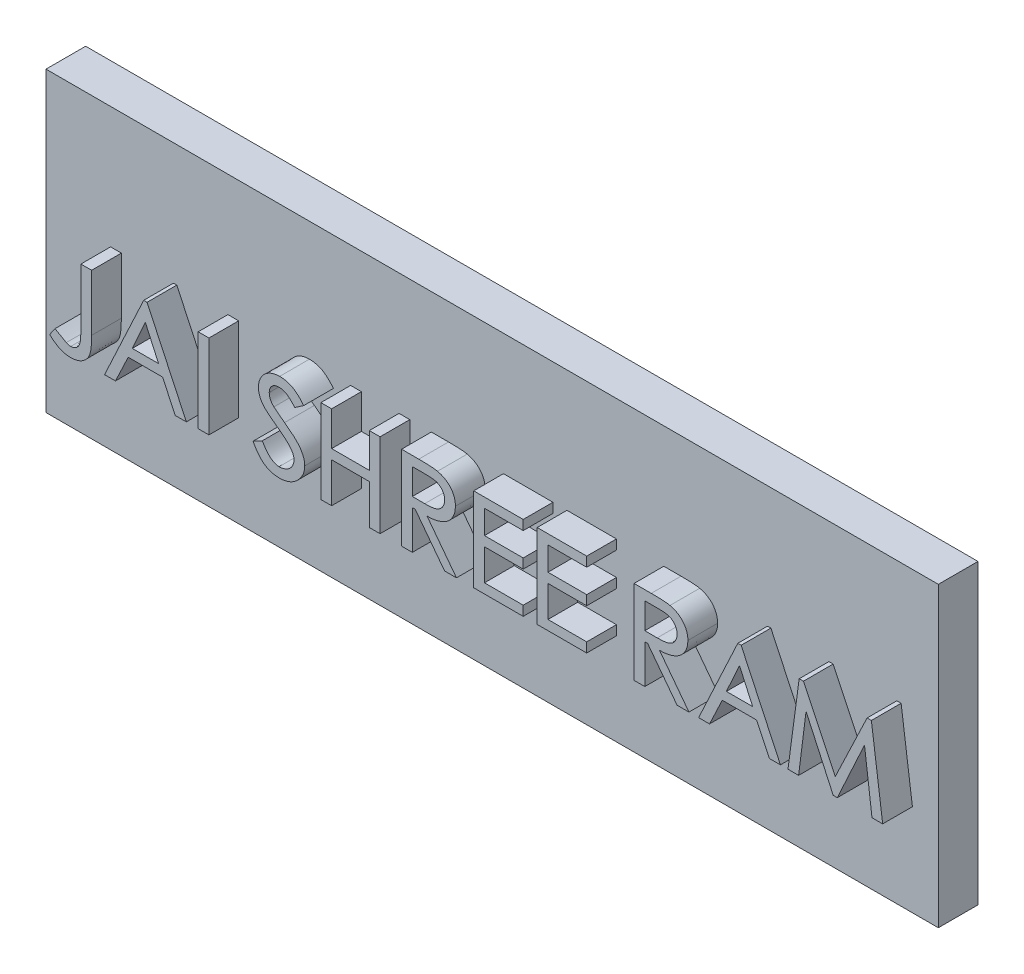
from build123d import *

# Parameters (mm, degrees)
SKETCH1_W           = 45
SKETCH1_H           = 15
BOSS_EXTRUDE1_DEPTH = 2
SKETCH2_W           = 0.542735043
SKETCH2_H           = 4.233333333
BOSS_EXTRUDE2_DEPTH = 1.5


with BuildPart() as part:
    # Sketch1 → Boss-Extrude1 (new body)
    with BuildSketch(Plane.XY):
        with Locations((22.5, 7.5)):
            Rectangle(SKETCH1_W, SKETCH1_H)
    extrude(amount=BOSS_EXTRUDE1_DEPTH)

    # Sketch2 → Boss-Extrude2 (add)
    # profile 1 of 11: a face of its own
    with BuildSketch(Plane.XY.offset(2)):
        with BuildLine():
            Line((3.258637598, 8.866404762), (3.801372641, 8.866404762))
            Line((3.801372641, 8.866404762), (3.801372641, 6.024677999))
            add(Edge.make_bspline(
                [(3.801372641, 6.024677999), (3.800962058, 5.973230325), (3.800172331, 5.874274331), (3.796559564, 5.73171127), (3.787848028, 5.601368951), (3.776693302, 5.482630425), (3.764224082, 5.375429481), (3.745925289, 5.280210179), (3.726352165, 5.196637917), (3.69467801, 5.101851328), (3.644727668, 4.995440013), (3.565170065, 4.880691951), (3.466364977, 4.778473084), (3.370394301, 4.703855635), (3.285042999, 4.652615476), (3.217213985, 4.617272433), (3.144983697, 4.58857176), (3.069009954, 4.566051015), (2.990099474, 4.547168402), (2.907397898, 4.533454315), (2.820915713, 4.525990227), (2.76199215, 4.525018687), (2.732015002, 4.52452442)],
                knots=[0, 0, 0, 0, 1.452672516, 2.794113746, 4.025812556, 5.140045592, 6.161674878, 7.071150553, 7.876425152, 8.583113845, 9.889795866, 11.180512384, 12.507055147, 13.889560834, 14.598589264, 15.316057477, 16.046722018, 16.789019803, 17.55176036, 18.336401437, 19.153650307, 20, 20, 20, 20], degree=3))
            add(Edge.make_bspline(
                [(2.732015002, 4.52452442), (2.689819523, 4.525556754), (2.605857441, 4.527610929), (2.480735627, 4.54764256), (2.357023073, 4.577611765), (2.232489143, 4.622001312), (2.104586679, 4.684264418), (1.97155606, 4.770277619), (1.828567192, 4.876253569), (1.734405544, 4.959088483), (1.684705974, 5.002809677)],
                knots=[0, 0, 0, 0, 0.856854487, 1.704999893, 2.568796624, 3.440919207, 4.38635173, 5.452546826, 6.655425746, 8, 8, 8, 8], degree=3))
            Line((1.684705974, 5.002809677), (1.953529425, 5.392900489))
            add(Edge.make_bspline(
                [(1.953529425, 5.392900489), (1.984850011, 5.373304051), (2.045309364, 5.335476279), (2.133431429, 5.282390459), (2.214490972, 5.233720651), (2.289600717, 5.191582408), (2.357198669, 5.153271336), (2.418001351, 5.119957091), (2.472812477, 5.092699933), (2.50726186, 5.076530709), (2.52340122, 5.06895551)],
                knots=[0, 0, 0, 0, 1.351848167, 2.609525467, 3.764319947, 4.811191365, 5.760578872, 6.607529217, 7.347634558, 8, 8, 8, 8], degree=3))
            add(Edge.make_bspline(
                [(2.52340122, 5.06895551), (2.543585872, 5.060279223), (2.582202316, 5.043680108), (2.640455887, 5.027349548), (2.694743921, 5.014901078), (2.73025582, 5.013606534), (2.747279425, 5.012985959)],
                knots=[0, 0, 0, 0, 1.133394633, 2.168363871, 3.121954873, 4, 4, 4, 4], degree=3))
            add(Edge.make_bspline(
                [(2.747279425, 5.012985959), (2.772542931, 5.014102581), (2.822583445, 5.016314322), (2.895480132, 5.034775878), (2.964401837, 5.065049073), (3.028889533, 5.106742081), (3.087157591, 5.158999479), (3.137007471, 5.221271073), (3.178102358, 5.291985958), (3.20326889, 5.35907051), (3.22055204, 5.420587542), (3.229523139, 5.478155039), (3.239289434, 5.545629846), (3.24680294, 5.62343926), (3.251226911, 5.711733179), (3.255795015, 5.810371945), (3.258167104, 5.91922899), (3.258476561, 5.995278999), (3.258637598, 6.034854281)],
                knots=[0, 0, 0, 0, 0.93789549, 1.85772999, 2.77510142, 3.725098534, 4.6996409, 5.670950193, 6.678238788, 7.725916441, 8.324833892, 9.050260382, 9.888218126, 10.859356959, 11.953767278, 13.173560852, 14.529163492, 16, 16, 16, 16], degree=3))
            Line((3.258637598, 6.034854281), (3.258637598, 8.866404762))
        make_face()
    # profile 2 of 11: a face of its own
    with BuildSketch(Plane.XY.offset(2)):
        Polygon((6.596458111, 8.866404762), (8.577441017, 4.633071429), (8.020289575, 4.633071429), (7.377487758, 5.989909036), (5.645823763, 5.989909036), (5.003021946, 4.633071429), (4.452654692, 4.633071429), (6.42685341, 8.866404762), align=None)
        Polygon((6.511655761, 7.941211119), (5.852741498, 6.478370574), (7.177354211, 6.478370574), align=None, mode=Mode.SUBTRACT)
    # profile 3 of 11: a face of its own
    with BuildSketch(Plane.XY.offset(2)):
        with Locations((9.445817085, 6.749738095)):
            Rectangle(SKETCH2_W, SKETCH2_H)
    # profile 4 of 11: a face of its own
    with BuildSketch(Plane.XY.offset(2)):
        with BuildLine():
            Line((11.942398282, 5.472614698), (12.403723068, 5.718541514))
            add(Edge.make_bspline(
                [(12.403723068, 5.718541514), (12.437342401, 5.662853683), (12.501598259, 5.55641881), (12.60710964, 5.413038399), (12.712016531, 5.290772592), (12.817354486, 5.189744837), (12.924586731, 5.111577941), (13.032618543, 5.055085092), (13.142126073, 5.019577458), (13.216167649, 5.015159503), (13.252594596, 5.012985959)],
                knots=[0, 0, 0, 0, 1.354943589, 2.589672558, 3.704607527, 4.708856974, 5.624398268, 6.459549776, 7.242129862, 8, 8, 8, 8], degree=3))
            add(Edge.make_bspline(
                [(13.252594596, 5.012985959), (13.286601112, 5.01407907), (13.353958236, 5.016244208), (13.452926401, 5.035021294), (13.54875379, 5.063630952), (13.639779891, 5.104370471), (13.723875504, 5.154281378), (13.798113444, 5.213648261), (13.861102267, 5.280860321), (13.91301966, 5.35500578), (13.95371561, 5.434170554), (13.983674075, 5.516108278), (14.001256705, 5.601055046), (14.003604608, 5.658252188), (14.004791444, 5.687164645)],
                knots=[0, 0, 0, 0, 1.0888553, 2.156709112, 3.216967111, 4.287545289, 5.343926646, 6.34269433, 7.323221176, 8.28571565, 9.233736345, 10.167849744, 11.073870434, 12, 12, 12, 12], degree=3))
            add(Edge.make_bspline(
                [(14.004791444, 5.687164645), (14.003128576, 5.720115719), (13.999768299, 5.786702303), (13.972797902, 5.88561747), (13.928966084, 5.983564798), (13.888420665, 6.044719495), (13.867411637, 6.076407433)],
                knots=[0, 0, 0, 0, 0.941861274, 1.903286225, 2.913566088, 4, 4, 4, 4], degree=3))
            add(Edge.make_bspline(
                [(13.867411637, 6.076407433), (13.84924505, 6.099473952), (13.811002842, 6.148030932), (13.74626963, 6.221134221), (13.670523277, 6.297391797), (13.583886654, 6.376459635), (13.487882573, 6.460109409), (13.380880247, 6.546179148), (13.263636107, 6.636123444), (13.181474668, 6.696465112), (13.138959446, 6.727689484)],
                knots=[0, 0, 0, 0, 0.718593868, 1.512701116, 2.388487339, 3.348232282, 4.383172848, 5.504845107, 6.708858268, 8, 8, 8, 8], degree=3))
            add(Edge.make_bspline(
                [(13.138959446, 6.727689484), (13.095605049, 6.75920673), (13.0124201, 6.819679498), (12.895219771, 6.908332857), (12.79013827, 6.990076166), (12.697981401, 7.064973316), (12.618738692, 7.133675281), (12.552577072, 7.195900145), (12.497504804, 7.249940294), (12.467910537, 7.286301043), (12.454604478, 7.30264942)],
                knots=[0, 0, 0, 0, 1.435833971, 2.754963323, 3.936484598, 5.002077172, 5.935979083, 6.744956812, 7.435712417, 8, 8, 8, 8], degree=3))
            add(Edge.make_bspline(
                [(12.454604478, 7.30264942), (12.435179432, 7.327748471), (12.397017365, 7.377057575), (12.348702868, 7.456152571), (12.307129325, 7.536282736), (12.272887348, 7.618190026), (12.246351878, 7.701612775), (12.228096729, 7.78684354), (12.215219864, 7.873543767), (12.214252236, 7.932118031), (12.213765803, 7.961563683)],
                knots=[0, 0, 0, 0, 1.064105702, 2.090521257, 3.104283852, 4.09061442, 5.065433238, 6.036507983, 7.012940167, 8, 8, 8, 8], degree=3))
            add(Edge.make_bspline(
                [(12.213765803, 7.961563683), (12.215297639, 8.007483687), (12.218330562, 8.098401934), (12.245433903, 8.231128955), (12.289355334, 8.357594102), (12.349307621, 8.477143748), (12.425865599, 8.587552585), (12.516928203, 8.686640166), (12.622988143, 8.77229215), (12.741215562, 8.844463012), (12.868650779, 8.902994061), (13.002869928, 8.944712312), (13.1422459, 8.970003394), (13.236942785, 8.973290089), (13.284819489, 8.974951771)],
                knots=[0, 0, 0, 0, 1.004530234, 1.988896367, 2.951881425, 3.928924249, 4.907494835, 5.884204368, 6.865296418, 7.88218147, 8.909671266, 9.927572845, 10.952225504, 12, 12, 12, 12], degree=3))
            add(Edge.make_bspline(
                [(13.284819489, 8.974951771), (13.339180754, 8.973005986), (13.446843503, 8.969152349), (13.605548515, 8.943036875), (13.757309498, 8.896017757), (13.879536221, 8.844117383), (13.974484027, 8.791053337), (14.046294995, 8.743127418), (14.119897533, 8.688888923), (14.192960432, 8.625634104), (14.268331285, 8.556423465), (14.342150501, 8.477494877), (14.419089705, 8.393371834), (14.468127939, 8.33270443), (14.493252983, 8.301621108)],
                knots=[0, 0, 0, 0, 1.360590218, 2.69465552, 4.010645498, 5.328858611, 6.009843139, 6.729980544, 7.488405022, 8.296451933, 9.147430815, 10.048128915, 10.999946711, 12, 12, 12, 12], degree=3))
            Line((14.493252983, 8.301621108), (14.050584714, 7.998028694))
            add(Edge.make_bspline(
                [(14.050584714, 7.998028694), (14.027483055, 8.022695012), (13.983064365, 8.070122152), (13.917725393, 8.137381083), (13.855905817, 8.197741167), (13.797418024, 8.250926275), (13.743572933, 8.297884897), (13.692857548, 8.337033577), (13.646857803, 8.370680089), (13.589354041, 8.404027496), (13.518858768, 8.43705427), (13.432095628, 8.466770792), (13.341084831, 8.482652446), (13.279503216, 8.485201094), (13.248354478, 8.486490232)],
                knots=[0, 0, 0, 0, 1.253377364, 2.409930098, 3.477532466, 4.457083962, 5.341772995, 6.126101147, 6.832963523, 7.453284126, 8.588253012, 9.715448048, 10.844445545, 12, 12, 12, 12], degree=3))
            add(Edge.make_bspline(
                [(13.248354478, 8.486490232), (13.215106527, 8.484936486), (13.150469793, 8.481915877), (13.057622516, 8.456049441), (12.972273423, 8.415233088), (12.896971593, 8.357467019), (12.834383069, 8.285968092), (12.788481896, 8.202216156), (12.761619264, 8.106769692), (12.758255135, 8.039757611), (12.756500846, 8.004812882)],
                knots=[0, 0, 0, 0, 1.033513523, 2.009234674, 2.977584268, 3.963375862, 4.942860848, 5.915719707, 6.913112236, 8, 8, 8, 8], degree=3))
            add(Edge.make_bspline(
                [(12.756500846, 8.004812882), (12.757184372, 7.982169823), (12.75854977, 7.936938472), (12.768579007, 7.869937982), (12.787118048, 7.805199614), (12.810610758, 7.741358838), (12.843492504, 7.678774361), (12.885369369, 7.617347358), (12.935081074, 7.555308121), (12.973232979, 7.516307267), (12.993099404, 7.495998779)],
                knots=[0, 0, 0, 0, 0.940834015, 1.879392378, 2.805520916, 3.734846727, 4.701501436, 5.734192883, 6.820151034, 8, 8, 8, 8], degree=3))
            add(Edge.make_bspline(
                [(12.993099404, 7.495998779), (13.003158621, 7.486535564), (13.026246632, 7.4648155), (13.068592526, 7.43155564), (13.120184396, 7.38985666), (13.181737491, 7.340399161), (13.255275813, 7.285868264), (13.338080393, 7.222620858), (13.432247848, 7.153504268), (13.49851375, 7.105048848), (13.533290376, 7.079619239)],
                knots=[0, 0, 0, 0, 0.485581606, 1.114511607, 1.892484918, 2.819534315, 3.891398566, 5.11240712, 6.484579029, 8, 8, 8, 8], degree=3))
            add(Edge.make_bspline(
                [(13.533290376, 7.079619239), (13.580669607, 7.045084629), (13.67232638, 6.978276223), (13.802527973, 6.877504535), (13.919951421, 6.778723494), (14.02756547, 6.68537934), (14.121730796, 6.59355647), (14.204211739, 6.505142872), (14.276044104, 6.42100153), (14.352761932, 6.313723672), (14.42946438, 6.181468505), (14.498052222, 6.021613285), (14.538980738, 5.860496996), (14.544702438, 5.752961238), (14.547526487, 5.699884997)],
                knots=[0, 0, 0, 0, 1.186540699, 2.295404303, 3.331123753, 4.291760032, 5.17774712, 5.991329992, 6.738459906, 7.414799035, 8.65800623, 9.82461674, 10.926299804, 12, 12, 12, 12], degree=3))
            add(Edge.make_bspline(
                [(14.547526487, 5.699884997), (14.546324864, 5.662228178), (14.543936547, 5.587382372), (14.52662059, 5.476718055), (14.497808359, 5.369156135), (14.456356746, 5.265150809), (14.404654383, 5.163725962), (14.340546911, 5.065768311), (14.264243286, 4.971655327), (14.178962634, 4.880818319), (14.084663763, 4.797335568), (13.98353893, 4.723859736), (13.875896877, 4.662478435), (13.762567082, 4.612678164), (13.64421451, 4.572097128), (13.519669566, 4.544302513), (13.389548233, 4.52825905), (13.300976339, 4.525782415), (13.25598669, 4.52452442)],
                knots=[0, 0, 0, 0, 0.932646097, 1.853705421, 2.767602683, 3.685675702, 4.622099834, 5.5835355, 6.579838097, 7.620108014, 8.666886363, 9.695041649, 10.711275682, 11.730160242, 12.757671447, 13.80585424, 14.885494678, 16, 16, 16, 16], degree=3))
            add(Edge.make_bspline(
                [(13.25598669, 4.52452442), (13.223179727, 4.525253105), (13.158563575, 4.526688312), (13.062635884, 4.535792087), (12.96928629, 4.553289452), (12.878002991, 4.575911783), (12.788729014, 4.604718266), (12.702614854, 4.64156704), (12.618226511, 4.683892949), (12.536048077, 4.733452204), (12.455974758, 4.791482189), (12.377551509, 4.858843588), (12.301233871, 4.936720531), (12.225713597, 5.024101233), (12.15198841, 5.121968545), (12.08023043, 5.22980785), (12.009523436, 5.347271397), (11.965214351, 5.430010082), (11.942398282, 5.472614698)],
                knots=[0, 0, 0, 0, 0.916943493, 1.805999526, 2.689245248, 3.568702553, 4.433092864, 5.307568578, 6.183755457, 7.069823058, 7.986358083, 8.944343836, 9.955449961, 11.030835633, 12.170024038, 13.377301724, 14.649494474, 16, 16, 16, 16], degree=3))
        make_face()
    # profile 5 of 11: a face of its own
    with BuildSketch(Plane.XY.offset(2)):
        Polygon((15.361629051, 8.866404762), (15.904364094, 8.866404762), (15.904364094, 7.129652625), (17.803936743, 7.129652625), (17.803936743, 8.866404762), (18.346671786, 8.866404762), (18.346671786, 4.633071429), (17.803936743, 4.633071429), (17.803936743, 6.641191087), (15.904364094, 6.641191087), (15.904364094, 4.633071429), (15.361629051, 4.633071429), align=None)
    # profile 6 of 11: a face of its own
    with BuildSketch(Plane.XY.offset(2)):
        with BuildLine():
            Line((19.432141872, 8.866404762), (20.298821893, 8.866404762))
            add(Edge.make_bspline(
                [(20.298821893, 8.866404762), (20.354510546, 8.866270112), (20.461088644, 8.866012415), (20.614019768, 8.863308237), (20.75287716, 8.859726793), (20.877765766, 8.852245675), (20.989020022, 8.845642202), (21.086158736, 8.834781339), (21.169639244, 8.825094625), (21.21983031, 8.814437294), (21.242672053, 8.809587187)],
                knots=[0, 0, 0, 0, 1.411347063, 2.701065231, 3.876524531, 4.931206492, 5.871916627, 6.700262025, 7.408494688, 8, 8, 8, 8], degree=3))
            add(Edge.make_bspline(
                [(21.242672053, 8.809587187), (21.276730833, 8.80102524), (21.343831818, 8.7841569), (21.440504111, 8.750946713), (21.531771409, 8.711794285), (21.617513421, 8.666914957), (21.697936305, 8.616083305), (21.771484147, 8.557765857), (21.841054293, 8.494941523), (21.903962387, 8.425639258), (21.961199239, 8.351944482), (22.010138246, 8.273870183), (22.052128345, 8.192464901), (22.08717381, 8.107849646), (22.113377882, 8.019080835), (22.131732317, 7.926811794), (22.144363997, 7.831316557), (22.145329636, 7.766276996), (22.145817085, 7.73344536)],
                knots=[0, 0, 0, 0, 1.103820101, 2.174693741, 3.209859002, 4.223626675, 5.214778413, 6.196198804, 7.171320727, 8.158999421, 9.134971582, 10.10159085, 11.051641808, 12.012235658, 12.97676874, 13.956376421, 14.968389326, 16, 16, 16, 16], degree=3))
            add(Edge.make_bspline(
                [(22.145817085, 7.73344536), (22.14400249, 7.679298674), (22.140436198, 7.572882143), (22.108025672, 7.417681597), (22.054913933, 7.271382351), (21.99433449, 7.157096886), (21.935401584, 7.072132629), (21.886061816, 7.01172956), (21.831818101, 6.955141207), (21.773055058, 6.901778431), (21.708226249, 6.85399937), (21.63930937, 6.808697343), (21.565491453, 6.767052004), (21.459086881, 6.717046445), (21.315168461, 6.664926551), (21.129214865, 6.620244081), (20.928277923, 6.593102579), (20.789348223, 6.589021119), (20.717745504, 6.586917583)],
                knots=[0, 0, 0, 0, 1.258986715, 2.474334223, 3.670931197, 4.871716255, 5.472099774, 6.075216246, 6.684756624, 7.295006596, 7.919971941, 8.55677058, 9.213641309, 9.890468445, 11.291088691, 12.766994829, 14.333747493, 16, 16, 16, 16], degree=3))
            Line((20.717745504, 6.586917583), (22.20009059, 4.633071429))
            Line((22.20009059, 4.633071429), (21.602234019, 4.633071429))
            Line((21.602234019, 4.633071429), (20.119888934, 6.586917583))
            Line((20.119888934, 6.586917583), (19.974876914, 6.586917583))
            Line((19.974876914, 6.586917583), (19.974876914, 4.633071429))
            Line((19.974876914, 4.633071429), (19.432141872, 4.633071429))
            Line((19.432141872, 4.633071429), (19.432141872, 8.866404762))
        make_face()
        with BuildLine():
            Line((19.974876914, 8.377943224), (19.974876914, 7.074531098))
            Line((19.974876914, 7.074531098), (20.597326167, 7.07029098))
            add(Edge.make_bspline(
                [(20.597326167, 7.07029098), (20.630684883, 7.070377172), (20.695160144, 7.070543763), (20.788486967, 7.073974086), (20.875049848, 7.079718262), (20.954506857, 7.088225727), (21.02662753, 7.098375419), (21.091964693, 7.10974316), (21.149904845, 7.125093239), (21.217586218, 7.147219821), (21.292781076, 7.182768266), (21.372548884, 7.236892252), (21.442468184, 7.300946662), (21.499805631, 7.376001765), (21.54568172, 7.458345478), (21.579055525, 7.546263782), (21.599159655, 7.639261111), (21.601759698, 7.702817526), (21.603082043, 7.735141407)],
                knots=[0, 0, 0, 0, 1.165824803, 2.253289887, 3.263370799, 4.197285623, 5.045371766, 5.808848116, 6.513348392, 7.138183875, 8.296069948, 9.40583476, 10.496436725, 11.595152671, 12.691956992, 13.780050175, 14.870965332, 16, 16, 16, 16], degree=3))
            add(Edge.make_bspline(
                [(21.603082043, 7.735141407), (21.60169714, 7.766322384), (21.598950238, 7.828168678), (21.579413092, 7.918936002), (21.544491036, 8.004566154), (21.498157416, 8.084949062), (21.440747822, 8.157212531), (21.374725476, 8.220889113), (21.298455974, 8.271361668), (21.228238353, 8.305427249), (21.16530795, 8.326791903), (21.109585712, 8.339985815), (21.046161072, 8.3516357), (20.97490444, 8.361874968), (20.895947508, 8.369355883), (20.809093322, 8.374062352), (20.714384743, 8.377760295), (20.648494431, 8.377880709), (20.614286637, 8.377943224)],
                knots=[0, 0, 0, 0, 1.114111647, 2.20979856, 3.297775031, 4.406653707, 5.514151176, 6.585969385, 7.670234779, 8.768154562, 9.365517569, 10.041721951, 10.812428959, 11.669578816, 12.61341719, 13.645562296, 14.777663698, 16, 16, 16, 16], degree=3))
            Line((20.614286637, 8.377943224), (19.974876914, 8.377943224))
        make_face(mode=Mode.SUBTRACT)
    # profile 7 of 11: a face of its own
    with BuildSketch(Plane.XY.offset(2)):
        Polygon((23.068466658, 8.866404762), (25.565047855, 8.866404762), (25.565047855, 8.377943224), (23.611201701, 8.377943224), (23.611201701, 7.18392613), (25.565047855, 7.18392613), (25.565047855, 6.695464591), (23.611201701, 6.695464591), (23.611201701, 5.121532967), (25.565047855, 5.121532967), (25.565047855, 4.633071429), (23.068466658, 4.633071429), align=None)
    # profile 8 of 11: a face of its own
    with BuildSketch(Plane.XY.offset(2)):
        Polygon((26.27060341, 8.866404762), (28.767184607, 8.866404762), (28.767184607, 8.377943224), (26.813338453, 8.377943224), (26.813338453, 7.18392613), (28.767184607, 7.18392613), (28.767184607, 6.695464591), (26.813338453, 6.695464591), (26.813338453, 5.121532967), (28.767184607, 5.121532967), (28.767184607, 4.633071429), (26.27060341, 4.633071429), align=None)
    # profile 9 of 11: a face of its own
    with BuildSketch(Plane.XY.offset(2)):
        with BuildLine():
            Line((31.155218795, 8.866404762), (32.021898816, 8.866404762))
            add(Edge.make_bspline(
                [(32.021898816, 8.866404762), (32.077587469, 8.866270112), (32.184165567, 8.866012415), (32.337096691, 8.863308237), (32.475954083, 8.859726793), (32.600842689, 8.852245675), (32.712096945, 8.845642202), (32.809235659, 8.834781339), (32.892716167, 8.825094625), (32.942907233, 8.814437294), (32.965748976, 8.809587187)],
                knots=[0, 0, 0, 0, 1.411347063, 2.701065231, 3.876524531, 4.931206492, 5.871916627, 6.700262025, 7.408494688, 8, 8, 8, 8], degree=3))
            add(Edge.make_bspline(
                [(32.965748976, 8.809587187), (32.999807756, 8.80102524), (33.066908741, 8.7841569), (33.163581034, 8.750946713), (33.254848332, 8.711794285), (33.340590344, 8.666914957), (33.421013228, 8.616083305), (33.49456107, 8.557765857), (33.564131216, 8.494941523), (33.627039311, 8.425639258), (33.684276162, 8.351944482), (33.733215169, 8.273870183), (33.775205268, 8.192464901), (33.810250733, 8.107849646), (33.836454805, 8.019080835), (33.85480924, 7.926811794), (33.86744092, 7.831316557), (33.868406559, 7.766276996), (33.868894008, 7.73344536)],
                knots=[0, 0, 0, 0, 1.103820101, 2.174693741, 3.209859002, 4.223626675, 5.214778413, 6.196198804, 7.171320727, 8.158999421, 9.134971582, 10.10159085, 11.051641808, 12.012235658, 12.97676874, 13.956376421, 14.968389326, 16, 16, 16, 16], degree=3))
            add(Edge.make_bspline(
                [(33.868894008, 7.73344536), (33.867079413, 7.679298674), (33.863513121, 7.572882143), (33.831102595, 7.417681597), (33.777990857, 7.271382351), (33.717411413, 7.157096886), (33.658478507, 7.072132629), (33.60913874, 7.01172956), (33.554895024, 6.955141207), (33.496131981, 6.901778431), (33.431303172, 6.85399937), (33.362386293, 6.808697343), (33.288568376, 6.767052004), (33.182163804, 6.717046445), (33.038245384, 6.664926551), (32.852291788, 6.620244081), (32.651354846, 6.593102579), (32.512425146, 6.589021119), (32.440822427, 6.586917583)],
                knots=[0, 0, 0, 0, 1.258986715, 2.474334223, 3.670931197, 4.871716255, 5.472099774, 6.075216246, 6.684756624, 7.295006596, 7.919971941, 8.55677058, 9.213641309, 9.890468445, 11.291088691, 12.766994829, 14.333747493, 16, 16, 16, 16], degree=3))
            Line((32.440822427, 6.586917583), (33.923167513, 4.633071429))
            Line((33.923167513, 4.633071429), (33.325310942, 4.633071429))
            Line((33.325310942, 4.633071429), (31.842965857, 6.586917583))
            Line((31.842965857, 6.586917583), (31.697953837, 6.586917583))
            Line((31.697953837, 6.586917583), (31.697953837, 4.633071429))
            Line((31.697953837, 4.633071429), (31.155218795, 4.633071429))
            Line((31.155218795, 4.633071429), (31.155218795, 8.866404762))
        make_face()
        with BuildLine():
            Line((31.697953837, 8.377943224), (31.697953837, 7.074531098))
            Line((31.697953837, 7.074531098), (32.32040309, 7.07029098))
            add(Edge.make_bspline(
                [(32.32040309, 7.07029098), (32.353761806, 7.070377172), (32.418237067, 7.070543763), (32.51156389, 7.073974086), (32.598126771, 7.079718262), (32.67758378, 7.088225727), (32.749704453, 7.098375419), (32.815041616, 7.10974316), (32.872981768, 7.125093239), (32.940663141, 7.147219821), (33.015857999, 7.182768266), (33.095625808, 7.236892252), (33.165545107, 7.300946662), (33.222882554, 7.376001765), (33.268758643, 7.458345478), (33.302132448, 7.546263782), (33.322236578, 7.639261111), (33.324836621, 7.702817526), (33.326158966, 7.735141407)],
                knots=[0, 0, 0, 0, 1.165824803, 2.253289887, 3.263370799, 4.197285623, 5.045371766, 5.808848116, 6.513348392, 7.138183875, 8.296069948, 9.40583476, 10.496436725, 11.595152671, 12.691956992, 13.780050175, 14.870965332, 16, 16, 16, 16], degree=3))
            add(Edge.make_bspline(
                [(33.326158966, 7.735141407), (33.324774063, 7.766322384), (33.322027161, 7.828168678), (33.302490015, 7.918936002), (33.267567959, 8.004566154), (33.221234339, 8.084949062), (33.163824745, 8.157212531), (33.0978024, 8.220889113), (33.021532898, 8.271361668), (32.951315276, 8.305427249), (32.888384873, 8.326791903), (32.832662635, 8.339985815), (32.769237995, 8.3516357), (32.697981363, 8.361874968), (32.619024431, 8.369355883), (32.532170245, 8.374062352), (32.437461666, 8.377760295), (32.371571354, 8.377880709), (32.33736356, 8.377943224)],
                knots=[0, 0, 0, 0, 1.114111647, 2.20979856, 3.297775031, 4.406653707, 5.514151176, 6.585969385, 7.670234779, 8.768154562, 9.365517569, 10.041721951, 10.812428959, 11.669578816, 12.61341719, 13.645562296, 14.777663698, 16, 16, 16, 16], degree=3))
            Line((32.33736356, 8.377943224), (31.697953837, 8.377943224))
        make_face(mode=Mode.SUBTRACT)
    # profile 10 of 11: a face of its own
    with BuildSketch(Plane.XY.offset(2)):
        Polygon((36.55543247, 8.866404762), (38.536415376, 4.633071429), (37.979263934, 4.633071429), (37.336462117, 5.989909036), (35.604798122, 5.989909036), (34.961996305, 4.633071429), (34.411629051, 4.633071429), (36.385827769, 8.866404762), align=None)
        Polygon((36.47063012, 7.941211119), (35.811715857, 6.478370574), (37.13632857, 6.478370574), align=None, mode=Mode.SUBTRACT)
    # profile 11 of 11: a face of its own
    with BuildSketch(Plane.XY.offset(2)):
        Polygon((38.916329906, 4.633071429), (39.481961583, 8.866404762), (39.695663506, 8.866404762), (41.300972, 5.501447497), (42.906280493, 8.866404762), (43.123374511, 8.866404762), (43.692398282, 4.633071429), (43.153903357, 4.633071429), (42.777380921, 7.618114164), (41.403582844, 4.633071429), (41.198361156, 4.633071429), (39.828803196, 7.618114164), (39.453976808, 4.633071429), align=None)
    extrude(amount=BOSS_EXTRUDE2_DEPTH)


solid = part.part
